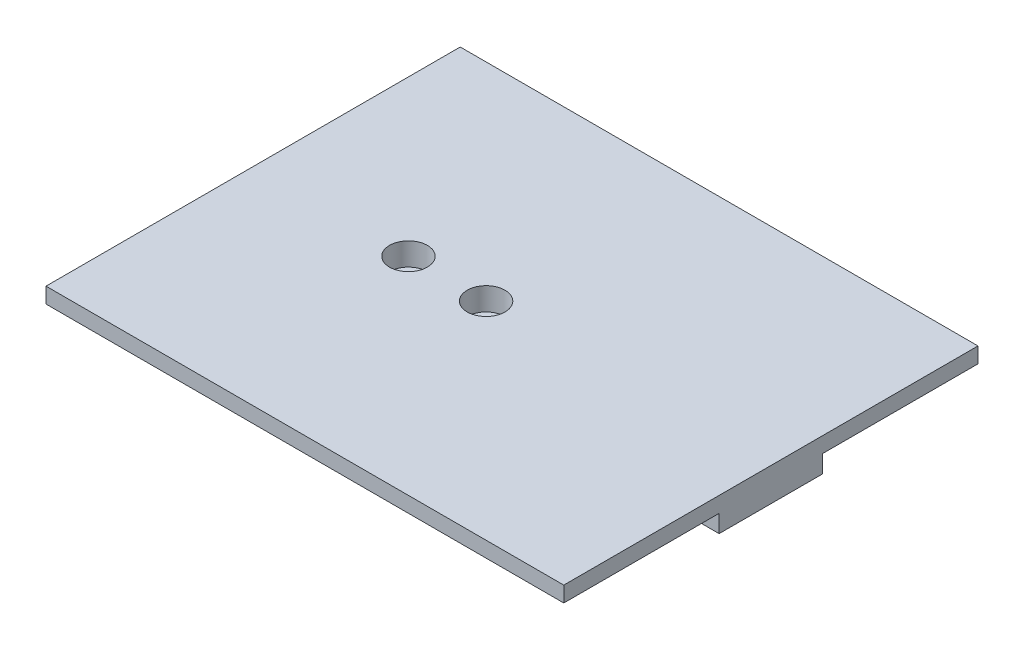
from build123d import *

# Parameters (mm, degrees)
SKETCH_1_W                   = 100
SKETCH_1_H                   = 80
EXTRUDE_1_DEPTH              = 3
SKETCH_2_W                   = 100
SKETCH_2_H                   = 20
EXTRUDE_2_DEPTH              = 3.4
HOLE_WIZARD_M4_1_D           = 4.2
HOLE_WIZARD_M4_1_CBORE_D     = 7.3
HOLE_WIZARD_M4_1_CBORE_DEPTH = 4.4


with BuildPart() as part:
    # 草圖1 → 填料-伸長1 (new body)
    with BuildSketch(Plane(origin=(0, 0, 0), x_dir=(1, 0, 0), z_dir=(0, 1, 0))):
        Rectangle(SKETCH_1_W, SKETCH_1_H)
    extrude(amount=EXTRUDE_1_DEPTH)

    # 草圖2 → 填料-伸長2 (add)
    with BuildSketch(Plane.XZ):
        Rectangle(SKETCH_2_W, SKETCH_2_H)
    extrude(amount=EXTRUDE_2_DEPTH)

    # M4 六角承窩頭蓋螺釘的柱孔1 (through all)
    with Locations(Plane(origin=(0, 3, 0), x_dir=(1, 0, 0), z_dir=(0, 1, 0))):
        with Locations((-20, 0), (-5, 0)):
            CounterBoreHole(HOLE_WIZARD_M4_1_D / 2, HOLE_WIZARD_M4_1_CBORE_D / 2, HOLE_WIZARD_M4_1_CBORE_DEPTH)


solid = part.part
